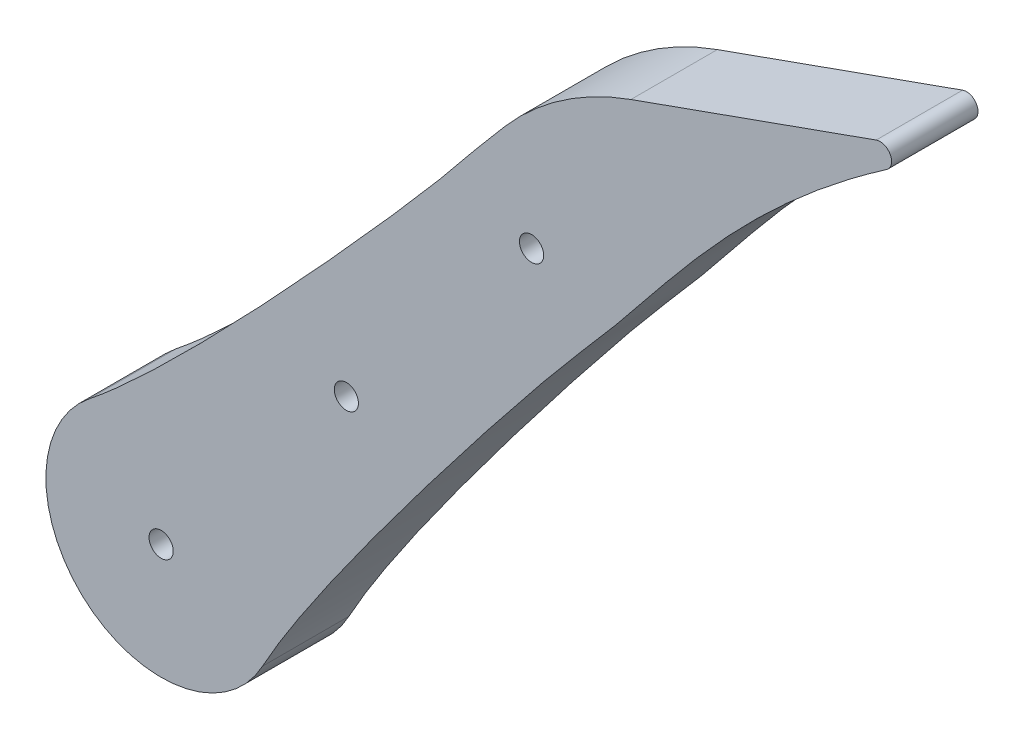
from build123d import *

# Parameters (mm, degrees)
SKETCH3_R           = 1.6
BOSS_EXTRUDE1_DEPTH = 15
CUT_EXTRUDE1_START  = -15
SKETCH4_R           = 1.6
CUT_EXTRUDE1_DEPTH  = 15
FILLET3_R           = 2
SKETCH5_R           = 2.1
CUT_EXTRUDE2_DEPTH  = 15
FILLET4_R           = 52


with BuildPart() as part:
    # Sketch3 → Boss-Extrude1 (new body)
    with BuildSketch(Plane.XY.offset(16)):
        with BuildLine():
            ThreePointArc((155.019115612, -142.985112199), (159.394881243, -97.849485606), (115.704809966, -109.996492831))
            add(Edge.make_bspline(
                [(115.704809966, -109.996492831), (101.94879758, -150.116707379), (78.178790791, -171.772825461), (58.717079478, -197.082387325), (16.356999542, -244.049515564), (0.72448619, -256.46124476)],
                knots=[0, 0, 0, 0, 0.619090324, 0.719090324, 1, 1, 1, 1], degree=3))
            ThreePointArc((0.72448619, -256.46124476), (0.304947846, -287.445485278), (30.74561606, -281.651963762))
            add(Edge.make_bspline(
                [(155.019115612, -142.985112199), (117.897123756, -163.498941991), (100.69762913, -190.668374405), (79.152067085, -214.229377889), (40.254225745, -264.101669257), (30.74561606, -281.651963762)],
                knots=[0, 0, 0, 0, 0.619090324, 0.719090324, 1, 1, 1, 1], degree=3))
        make_face()
        with Locations((135.218221977, -112.415707792)):
            Circle(SKETCH3_R, mode=Mode.SUBTRACT)
        with Locations((148.218221977, -112.415707792)):
            Circle(SKETCH3_R, mode=Mode.SUBTRACT)
        with Locations((148.218221977, -125.415707792)):
            Circle(SKETCH3_R, mode=Mode.SUBTRACT)
        with Locations((135.218221977, -125.415707792)):
            Circle(SKETCH3_R, mode=Mode.SUBTRACT)
        with Locations((77.439461008, -195.520152104)):
            Circle(SKETCH3_R, mode=Mode.SUBTRACT)
        with Locations((45.300080524, -233.82237426)):
            Circle(SKETCH3_R, mode=Mode.SUBTRACT)
        with Locations((13.16070004, -272.124596416)):
            Circle(SKETCH3_R, mode=Mode.SUBTRACT)
    extrude(amount=BOSS_EXTRUDE1_DEPTH)

    # Sketch4 → Cut-Extrude1 (cut)
    with BuildSketch(Plane.XY.offset(31).offset(CUT_EXTRUDE1_START)):
        with BuildLine():
            Line((146.658363589, -145.968341691), (155.019115612, -142.985112199))
            ThreePointArc((155.019115612, -142.985112199), (160.577014812, -98.900815017), (116.900921238, -107.068700404))
            ThreePointArc((116.900921238, -107.068700404), (116.260741116, -108.51538721), (115.704809966, -109.996492831))
            add(Edge.make_bspline(
                [(115.704809966, -109.996492831), (106.087737983, -138.045245656), (93.191817184, -155.597417592), (81.785181072, -169.115971326)],
                knots=[0, 0, 0, 0, 0.432817014, 0.432817014, 0.432817014, 0.432817014], degree=3))
            Line((81.785181072, -169.115971326), (146.658363589, -145.968341691))
        make_face()
        with Locations((135.218221977, -125.415707792)):
            Circle(SKETCH4_R, mode=Mode.SUBTRACT)
        with Locations((148.218221977, -125.415707792)):
            Circle(SKETCH4_R, mode=Mode.SUBTRACT)
        with Locations((135.218221977, -112.415707792)):
            Circle(SKETCH4_R, mode=Mode.SUBTRACT)
        with Locations((148.218221977, -112.415707792)):
            Circle(SKETCH4_R, mode=Mode.SUBTRACT)
    extrude(amount=CUT_EXTRUDE1_DEPTH, mode=Mode.SUBTRACT)

    # Fillet3
    fillet3_edges = [part.edges().sort_by_distance(p)[0] for p in [
        (155.019115612, -142.985112199, 23.5),
    ]]
    fillet(fillet3_edges, radius=FILLET3_R)

    # Sketch5 → Cut-Extrude2 (cut)
    with BuildSketch(Plane.XY.offset(31)):
        with Locations((77.439461008, -195.520152104)):
            Circle(SKETCH5_R)
        with Locations((45.300080524, -233.82237426)):
            Circle(SKETCH5_R)
        with Locations((13.16070004, -272.124596416)):
            Circle(SKETCH5_R)
    extrude(amount=-CUT_EXTRUDE2_DEPTH, mode=Mode.SUBTRACT)

    # Fillet4
    fillet4_edges = [part.edges().sort_by_distance(p)[0] for p in [
        (81.785181072, -169.115971326, 23.5),
    ]]
    fillet(fillet4_edges, radius=FILLET4_R)


solid = part.part
